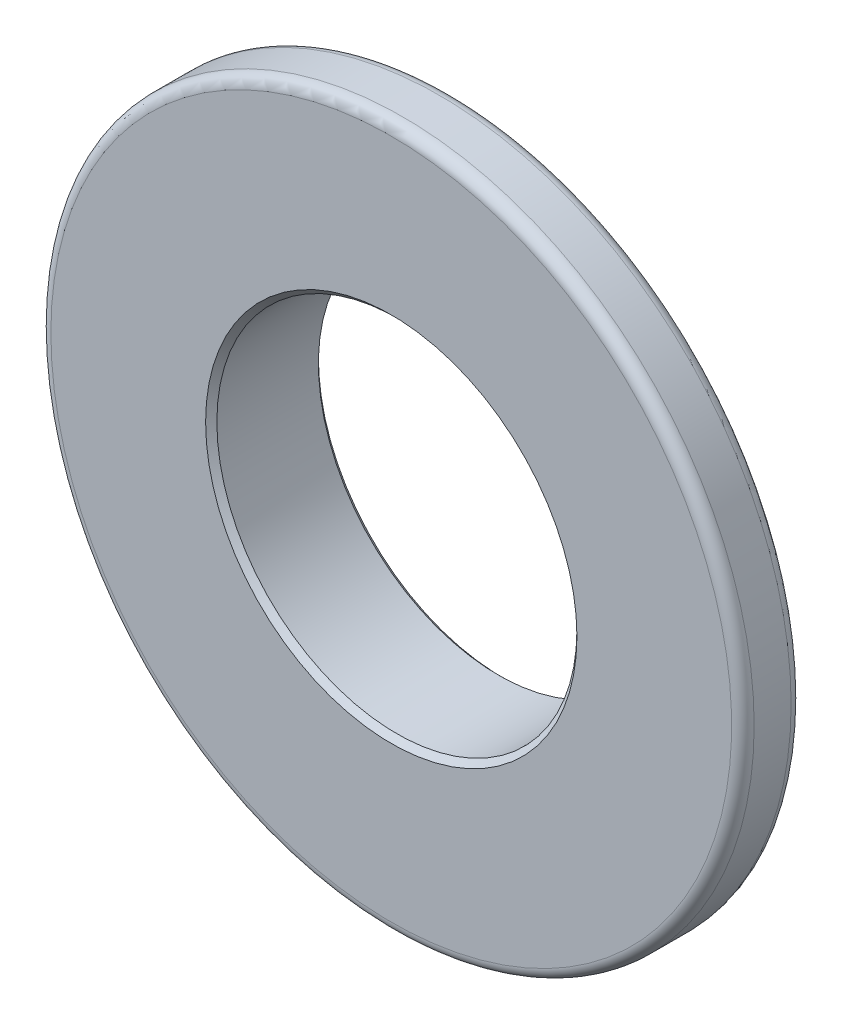
from build123d import *
from OCP.BRepFilletAPI import BRepFilletAPI_MakeChamfer

# Parameters (mm, degrees)
CHAMFER1_SIZE  = 0.254
CHAMFER1_SIZE2 = 0.213389286
FILLET1_R      = 0.508


with BuildPart() as part:
    # Sketch1 → Revolve1 (revolve)
    with BuildSketch(Plane(origin=(0, 0, 0), x_dir=(0, 0, -1), z_dir=(1, 0, 0)), mode=Mode.PRIVATE) as revolve1_sk:
        with BuildLine():
            Line((32.131, 15.875), (32.131, 8.128))
            Line((32.131, 8.128), (37.222917887, 8.128))
            ThreePointArc((37.222917887, 8.128), (36.1372367, 12.071044848), (34.635160964, 15.875))
            Line((34.635160964, 15.875), (32.131, 15.875))
        make_face()
    revolve(revolve1_sk.sketch.rotate(Axis((0, 0, 0), (0, 0, -1)), 90), axis=Axis((0, 0, 0), (0, 0, -1)))

    # Chamfer1: one chamfer whose edges measure the first distance from different faces: ONE call of the kernel's chamfer builder (chamfer() names one face for all edges)
    chamfer1_edges_1 = [part.edges().sort_by_distance(p)[0] for p in [
        (-8.128, 0, -37.222917887),
    ]]
    chamfer1_side_1 = [part.faces().sort_by_distance(p)[0] for p in [
        (-8.128, 0, -34.676958943),
    ]]
    chamfer1_edges_2 = [part.edges().sort_by_distance(p)[0] for p in [
        (-8.128, 0, -32.131),
    ]]
    chamfer1 = BRepFilletAPI_MakeChamfer(part.part.solid().wrapped)
    for e in chamfer1_edges_1:
        chamfer1.Add(CHAMFER1_SIZE, CHAMFER1_SIZE2, e.wrapped, chamfer1_side_1[0].wrapped)  # the first distance lies on this face
    for e in chamfer1_edges_2:
        chamfer1.Add(CHAMFER1_SIZE, e.wrapped)
    add(Compound.cast(chamfer1.Shape()), mode=Mode.REPLACE)

    # Fillet1
    fillet1_edges = [part.edges().sort_by_distance(p)[0] for p in [
        (-15.875, 0, -34.635160964),
        (-15.875, 0, -32.131),
    ]]
    fillet(fillet1_edges, radius=FILLET1_R)


solid = part.part
